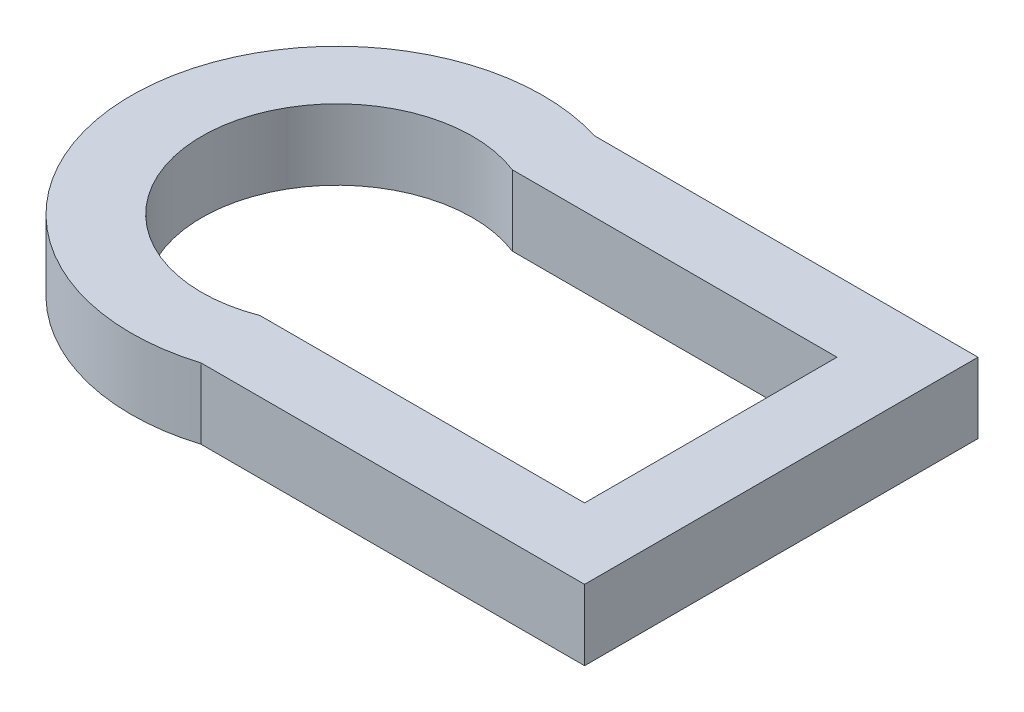
from build123d import *

# Parameters (mm, degrees)
BOSS_EXTRUDE1_DEPTH = 5


with BuildPart() as part:
    # Sketch1 → Boss-Extrude1 (new body)
    with BuildSketch(Plane(origin=(0, 0, 0), x_dir=(1, 0, 0), z_dir=(0, 1, 0))):
        with BuildLine():
            Line((4.307841687, -13.95), (31.5, -13.95))
            Line((31.5, -13.95), (31.5, 13.95))
            Line((31.5, 13.95), (4.307841687, 13.95))
            ThreePointArc((4.307841687, 13.95), (-14.6, 0), (4.307841687, -13.95))
        make_face()
        with BuildLine():
            Line((3.472391107, -8.95), (26.5, -8.95))
            Line((26.5, -8.95), (26.5, 8.95))
            Line((26.5, 8.95), (3.472391107, 8.95))
            ThreePointArc((3.472391107, 8.95), (-9.6, 0), (3.472391107, -8.95))
        make_face(mode=Mode.SUBTRACT)
    extrude(amount=BOSS_EXTRUDE1_DEPTH)


solid = part.part
